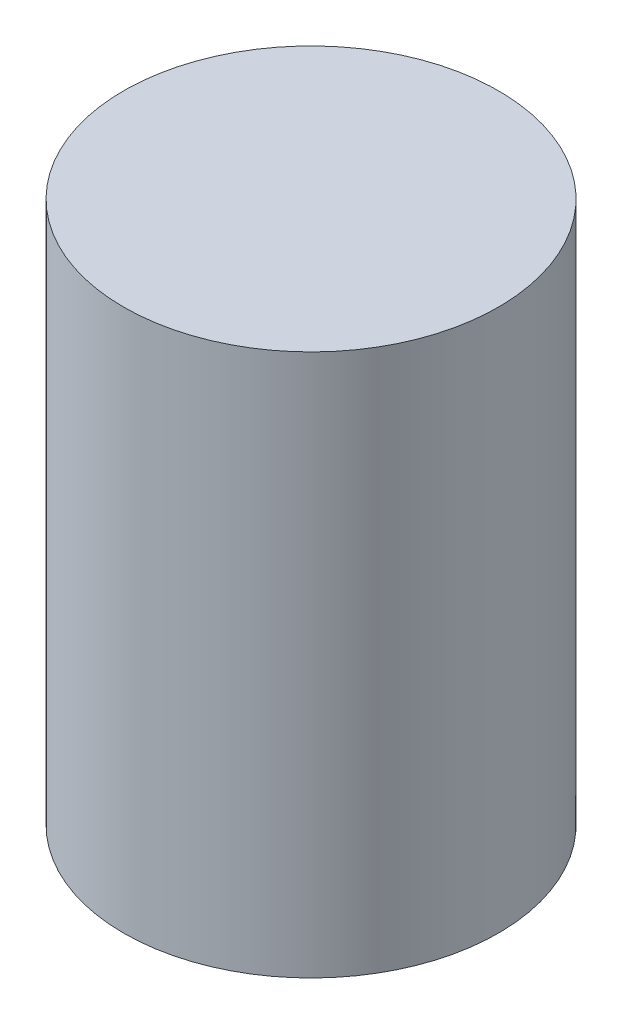
from build123d import *

# Parameters (mm, degrees)
SKETCH1_R           = 15
BOSS_EXTRUDE1_DEPTH = 43.4


with BuildPart() as part:
    # Sketch1 → Boss-Extrude1 (new body)
    with BuildSketch(Plane(origin=(0, 0, 0), x_dir=(1, 0, 0), z_dir=(0, 1, 0))):
        with Locations(Location((0, 0, 0), (0, 0, 270))):
            Circle(SKETCH1_R)
    extrude(amount=BOSS_EXTRUDE1_DEPTH)


solid = part.part
